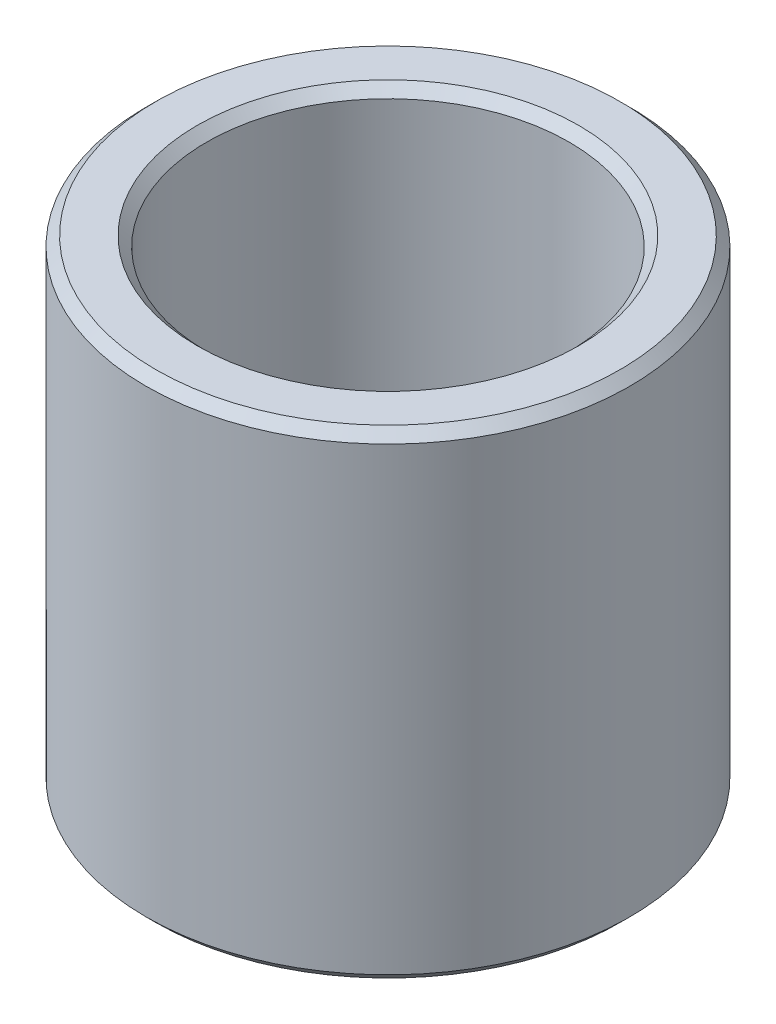
from build123d import *

# Parameters (mm, degrees)
SKETCH1_R           = 6.3881
SKETCH1_R_2         = 4.7879
BOSS_EXTRUDE1_DEPTH = 12.6492
CHAMFER1_SIZE       = 0.254


with BuildPart() as part:
    # Sketch1 → Boss-Extrude1 (new body)
    with BuildSketch(Plane(origin=(0, 0, 0), x_dir=(1, 0, 0), z_dir=(0, 1, 0))):
        with Locations(Location((0, 0, 0), (0, 0, 270))):
            Circle(SKETCH1_R)
        with Locations(Location((0, 0, 0), (0, 0, 270))):
            Circle(SKETCH1_R_2, mode=Mode.SUBTRACT)
    extrude(amount=BOSS_EXTRUDE1_DEPTH)

    # Chamfer1
    chamfer1_edges = [part.edges().sort_by_distance(p)[0] for p in [
        (0, 0, -6.3881),
        (0, 12.6492, -6.3881),
        (0, 0, -4.7879),
        (0, 12.6492, -4.7879),
    ]]
    chamfer(chamfer1_edges, length=CHAMFER1_SIZE)


solid = part.part
